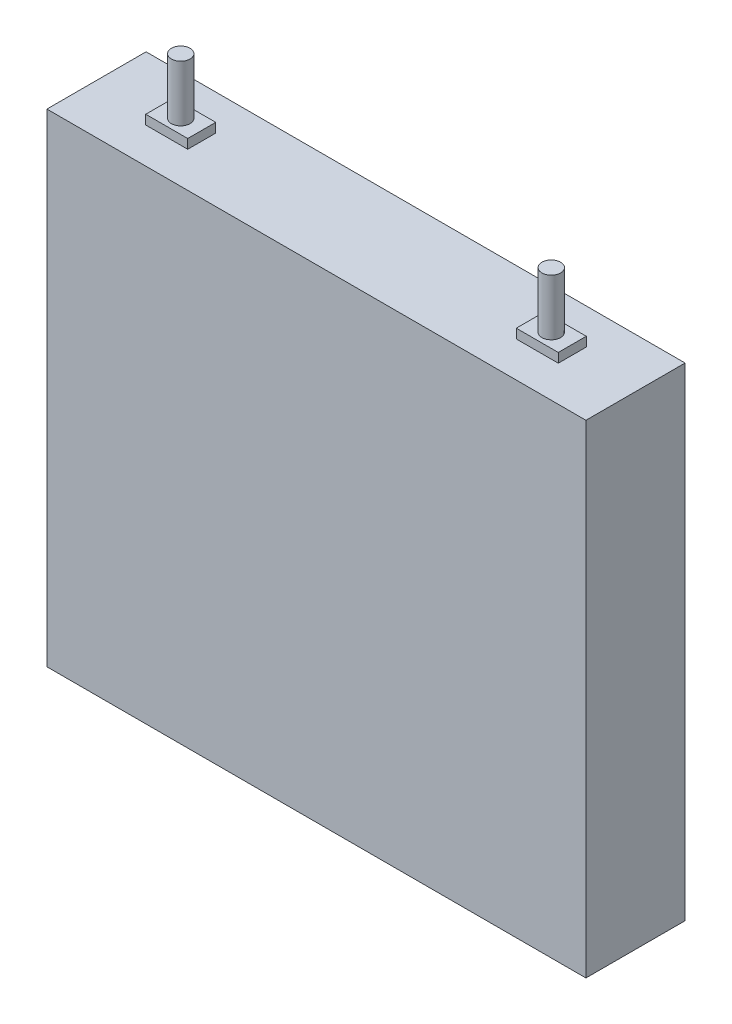
from build123d import *

# Parameters (mm, degrees)
SKETCH1_W             = 115.5
SKETCH1_H             = 103.5
CELL_BODY_DEPTH       = 10.625
SKETCH2_W             = 9
SKETCH2_H             = 6
SCREW_TERMINALS_DEPTH = 2
SKETCH3_R             = 2
SCREWS_DEPTH          = 12


with BuildPart() as part:
    # Sketch1 → Cell Body (new, symmetric)
    with BuildSketch(Plane.XY):
        Rectangle(SKETCH1_W, SKETCH1_H)
    extrude(amount=CELL_BODY_DEPTH, both=True)

    # Sketch2 → Screw Terminals (add)
    with BuildSketch(Plane(origin=(0, 51.75, 0), x_dir=(1, 0, 0), z_dir=(0, 1, 0))):
        with Locations((-39.7, 0)):
            Rectangle(SKETCH2_W, SKETCH2_H)
        with Locations((39.7, 0)):
            Rectangle(SKETCH2_W, SKETCH2_H)
    extrude(amount=SCREW_TERMINALS_DEPTH)

    # Sketch3 → Screws (add)
    with BuildSketch(Plane(origin=(0, 53.75, 0), x_dir=(1, 0, 0), z_dir=(0, 1, 0))):
        with Locations((-39.7, 0)):
            Circle(SKETCH3_R)
        with Locations((39.7, 0)):
            Circle(SKETCH3_R)
    extrude(amount=SCREWS_DEPTH)


solid = part.part
